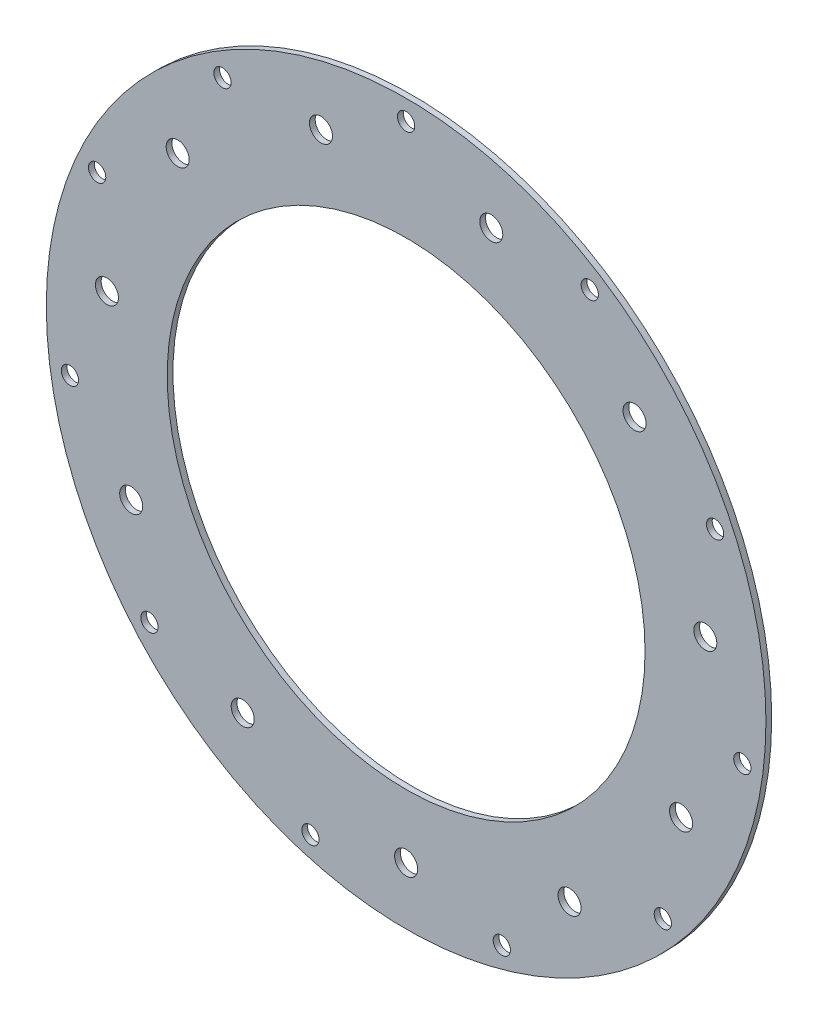
from build123d import *

# Parameters (mm, degrees)
SKETCH_1_R      = 62.5
SKETCH_1_R_2    = 41.5
SKETCH_1_R_3    = 2
SKETCH_1_R_4    = 1.5
EXTRUDE_1_DEPTH = 1


with BuildPart() as part:
    # 草图1 → 凸台-拉伸1 (new body)
    with BuildSketch(Plane.XY):
        Circle(SKETCH_1_R)
        Circle(SKETCH_1_R_2, mode=Mode.SUBTRACT)
        with Locations((0, -52.5)):
            Circle(SKETCH_1_R_3, mode=Mode.SUBTRACT)
        with Locations((-28.383642916, -44.165810474)):
            Circle(SKETCH_1_R_3, mode=Mode.SUBTRACT)
        with Locations((-47.755679756, -21.809288183)):
            Circle(SKETCH_1_R_3, mode=Mode.SUBTRACT)
        with Locations((-51.965625699, 7.471529009)):
            Circle(SKETCH_1_R_3, mode=Mode.SUBTRACT)
        with Locations((-39.676852654, 34.380188532)):
            Circle(SKETCH_1_R_3, mode=Mode.SUBTRACT)
        with Locations((-14.790959234, 50.373381115)):
            Circle(SKETCH_1_R_3, mode=Mode.SUBTRACT)
        with Locations((14.790959234, 50.373381115)):
            Circle(SKETCH_1_R_3, mode=Mode.SUBTRACT)
        with Locations((39.676852654, 34.380188532)):
            Circle(SKETCH_1_R_3, mode=Mode.SUBTRACT)
        with Locations((51.965625699, 7.471529009)):
            Circle(SKETCH_1_R_3, mode=Mode.SUBTRACT)
        with Locations((47.755679756, -21.809288183)):
            Circle(SKETCH_1_R_3, mode=Mode.SUBTRACT)
        with Locations((28.383642916, -44.165810474)):
            Circle(SKETCH_1_R_3, mode=Mode.SUBTRACT)
        with Locations((-16.622220854, -56.610085443)):
            Circle(SKETCH_1_R_4, mode=Mode.SUBTRACT)
        with Locations((-44.589224887, -38.636783303)):
            Circle(SKETCH_1_R_4, mode=Mode.SUBTRACT)
        with Locations((-58.399465071, -8.396575458)):
            Circle(SKETCH_1_R_4, mode=Mode.SUBTRACT)
        with Locations((-53.668287726, 24.509485767)):
            Circle(SKETCH_1_R_4, mode=Mode.SUBTRACT)
        with Locations((-31.89780823, 49.633958437)):
            Circle(SKETCH_1_R_4, mode=Mode.SUBTRACT)
        with Locations((0, 59)):
            Circle(SKETCH_1_R_4, mode=Mode.SUBTRACT)
        with Locations((31.89780823, 49.633958437)):
            Circle(SKETCH_1_R_4, mode=Mode.SUBTRACT)
        with Locations((53.668287726, 24.509485767)):
            Circle(SKETCH_1_R_4, mode=Mode.SUBTRACT)
        with Locations((58.399465071, -8.396575458)):
            Circle(SKETCH_1_R_4, mode=Mode.SUBTRACT)
        with Locations((44.589224887, -38.636783303)):
            Circle(SKETCH_1_R_4, mode=Mode.SUBTRACT)
        with Locations((16.622220854, -56.610085443)):
            Circle(SKETCH_1_R_4, mode=Mode.SUBTRACT)
    extrude(amount=EXTRUDE_1_DEPTH)


solid = part.part
